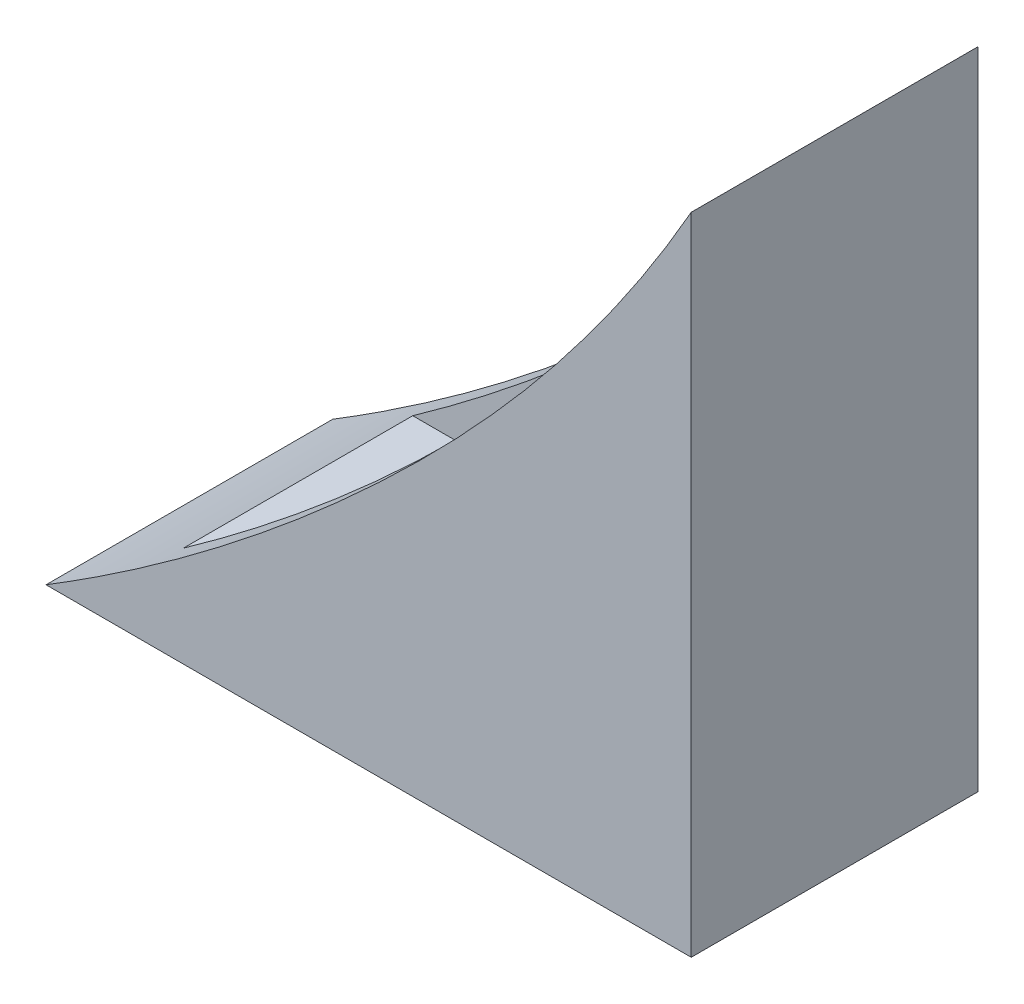
from build123d import *

# Parameters (mm, degrees)
BOSS_EXTRUDE1_DEPTH = 20
CUT_EXTRUDE1_START  = -5
SKETCH2_W           = 40
SKETCH2_H           = 16
CUT_EXTRUDE1_DEPTH  = 62.708320486


with BuildPart() as part:
    # Sketch1 → Boss-Extrude1 (new body)
    with BuildSketch(Plane.XY):
        with BuildLine():
            Line((0, 0), (0, 45))
            add(Edge.make_bspline(
                [(0, 45), (-6.04309054, 34.377032995), (-19.596555361, 18.290474097), (-36.768954214, 5.047598121), (-45, 0)],
                knots=[0, 0, 0, 0, 0.55, 1, 1, 1, 1], degree=3))
            Line((-45, 0), (0, 0))
        make_face()
    extrude(amount=BOSS_EXTRUDE1_DEPTH)

    # Sketch2 → Cut-Extrude1 (cut, through all)
    with BuildSketch(Plane.XZ.offset(CUT_EXTRUDE1_START)):
        with Locations((-25, 10)):
            Rectangle(SKETCH2_W, SKETCH2_H)
    extrude(amount=-CUT_EXTRUDE1_DEPTH, mode=Mode.SUBTRACT)


solid = part.part
